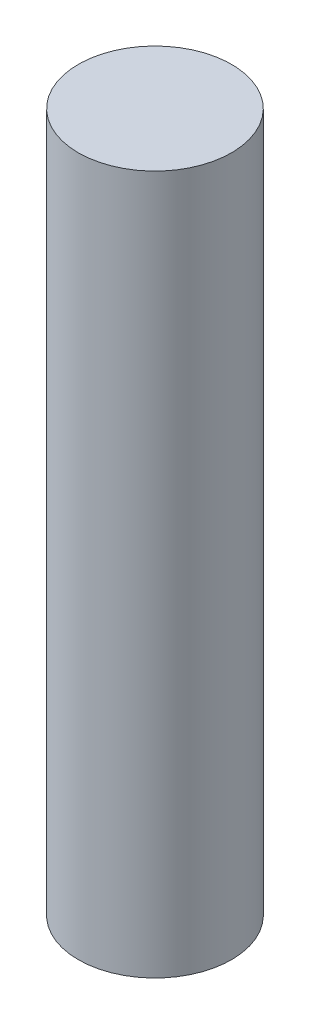
from build123d import *

# Parameters (mm, degrees)
SKETCH1_R           = 50.8
BOSS_EXTRUDE1_DEPTH = 463.296


with BuildPart() as part:
    # Sketch1 → Boss-Extrude1 (new body)
    with BuildSketch(Plane(origin=(0, 0, 0), x_dir=(1, 0, 0), z_dir=(0, 1, 0))):
        with Locations(Location((0, 0, 0), (0, 0, 270))):
            Circle(SKETCH1_R)
    extrude(amount=BOSS_EXTRUDE1_DEPTH)


solid = part.part
